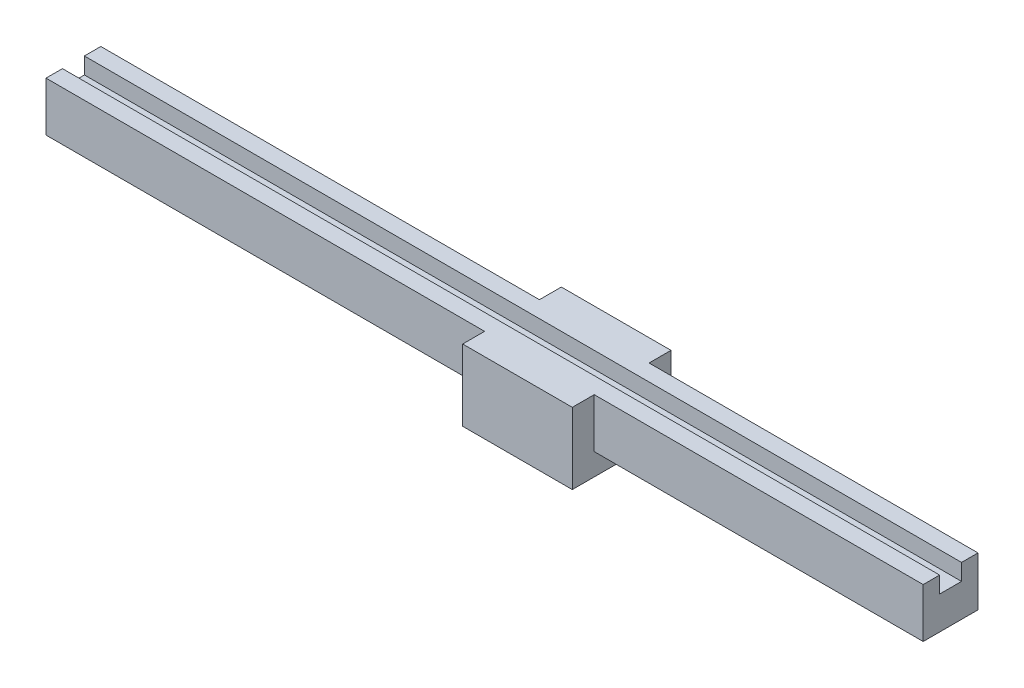
from build123d import *

# Parameters (mm, degrees)
SKETCH6_W               = 2.5
SKETCH6_H               = 2.25
BOSS_EXTRUDE1_DEPTH     = 20
CUT_EXTRUDE1_DEPTH      = 21.070578592
CUT_EXTRUDE1_DEPTH_BACK = 21.070578592
SKETCH7_W               = 1
SKETCH7_H               = 0.75
BOSS_EXTRUDE2_DEPTH     = 5


with BuildPart() as part:
    # Sketch6 → Boss-Extrude1 (new, symmetric)
    with BuildSketch(Plane(origin=(0, 0, 0), x_dir=(0, 0, -1), z_dir=(1, 0, 0))):
        Rectangle(SKETCH6_W, SKETCH6_H)
    extrude(amount=BOSS_EXTRUDE1_DEPTH, both=True)

    # Sketch7 → Cut-Extrude1 (cut, two sides: drawn at the far end of the back side and taken through both)
    with BuildSketch(Plane(origin=(0, 0, 0), x_dir=(0, 0, -1), z_dir=(1, 0, 0)).offset(-CUT_EXTRUDE1_DEPTH_BACK)):
        with Locations((0, 0.75)):
            Rectangle(SKETCH7_W, SKETCH7_H)
    extrude(amount=CUT_EXTRUDE1_DEPTH + CUT_EXTRUDE1_DEPTH_BACK, mode=Mode.SUBTRACT)

    # Sketch8 → Boss-Extrude2 (add)
    with BuildSketch(Plane(origin=(0, 0, 0), x_dir=(0, 0, -1), z_dir=(1, 0, 0))):
        Polygon((-2.25, 1.125), (-1.25, 1.125), (-1.25, -1.125), (1.25, -1.125), (1.25, 1.125), (2.25, 1.125), (2.25, -2.125), (-2.25, -2.125), align=None)
    extrude(amount=BOSS_EXTRUDE2_DEPTH)


solid = part.part
